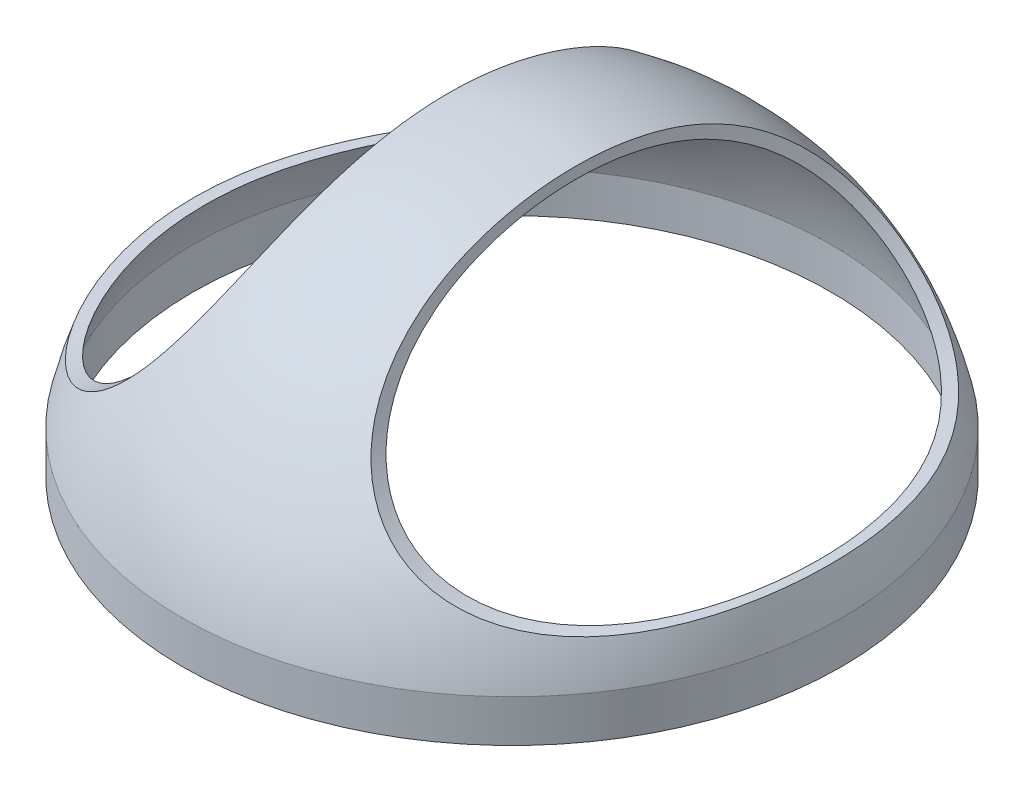
from build123d import *

# Parameters (mm, degrees)
SKETCH_7_W               = 31.224989992
SKETCH_7_H               = 4
SHELL_2_T                = -1
CUT_EXTRUDE_4_DEPTH      = 55.534392818
CUT_EXTRUDE_4_DEPTH_BACK = 55.534392818


with BuildPart() as part:
    # 草图7 → 旋转12 (revolve)
    with BuildSketch(Plane.XY, mode=Mode.PRIVATE) as revolve_12_sk:
        with BuildLine():
            ThreePointArc((31.224989992, 7), (20, 24.979991994), (0, 32))
            Line((0, 32), (0, 7))
            Line((0, 7), (31.224989992, 7))
        make_face()
        with Locations((15.612494996, 5)):
            Rectangle(SKETCH_7_W, SKETCH_7_H)
    revolve(revolve_12_sk.sketch.rotate(Axis((0, 32, 0), (0, -1, 0)), 180), axis=Axis((0, 32, 0), (0, -1, 0)))

    # 抽壳2
    shell_2_openings = [part.faces().sort_by_distance(p)[0] for p in [
        (0, 3, 0),
    ]]
    offset(amount=SHELL_2_T, openings=shell_2_openings, kind=Kind.INTERSECTION)

    # 草图9 → 切除-拉伸4 (cut, two sides: drawn at the far end of the back side and taken through both)
    with BuildSketch(Plane.XY.offset(-CUT_EXTRUDE_4_DEPTH_BACK)):
        with BuildLine():
            ThreePointArc((-6.007581703, 31.431019107), (-13.478809235, 15.768247098), (-30.113359103, 10.825229952))
            ThreePointArc((-30.113359103, 10.825229952), (-20.792552221, 24.324263034), (-6.007581703, 31.431019107))
        make_face()
        with BuildLine():
            ThreePointArc((30.113359103, 10.825229952), (20.792552221, 24.324263034), (6.007581703, 31.431019107))
            ThreePointArc((6.007581703, 31.431019107), (13.478809235, 15.768247098), (30.113359103, 10.825229952))
        make_face()
    extrude(amount=CUT_EXTRUDE_4_DEPTH + CUT_EXTRUDE_4_DEPTH_BACK, mode=Mode.SUBTRACT)


solid = part.part
